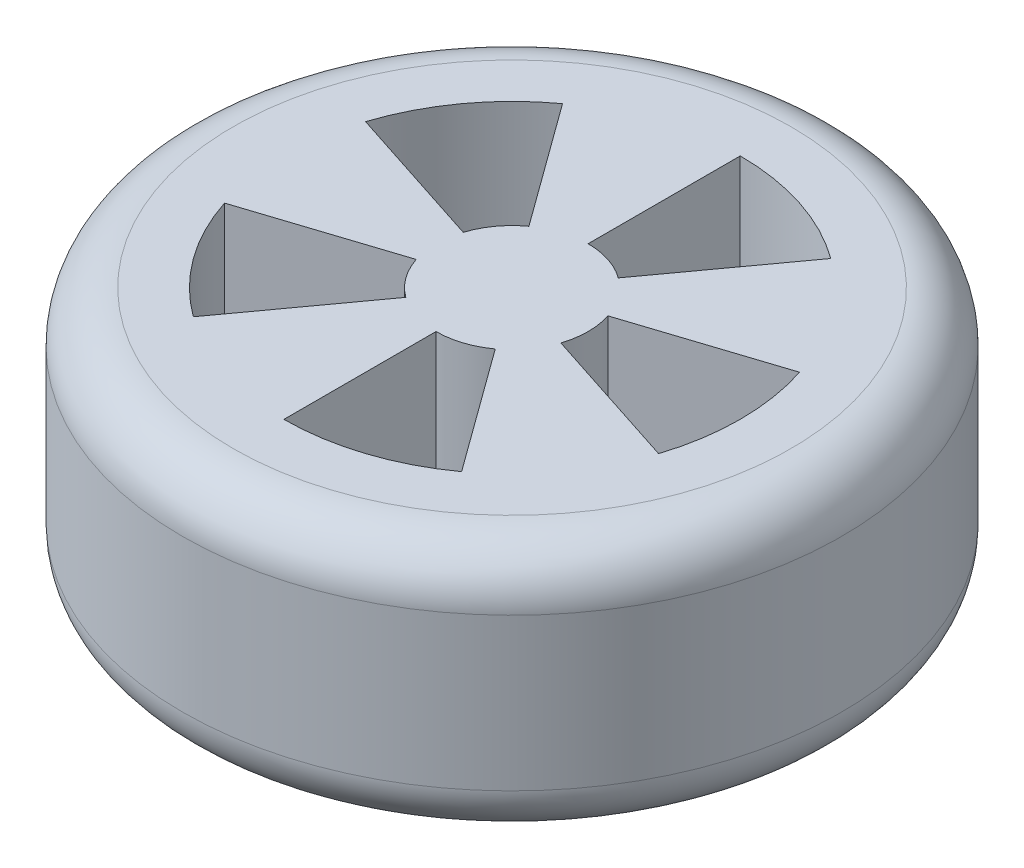
from build123d import *

# Parameters (mm, degrees)
SKETCH_1_R      = 32.5
EXTRUDE_1_DEPTH = 25
FILLET_1_R      = 5
FILLET_2_R      = 5


with BuildPart() as part:
    # 草图1 → 凸台-拉伸1 (new body)
    with BuildSketch(Plane(origin=(0, 0, 0), x_dir=(1, 0, 0), z_dir=(0, 1, 0))):
        with Locations(Location((0, 0, 0), (0, 0, 270))):
            Circle(SKETCH_1_R)
        with BuildLine():
            Line((0, 7.5), (0, 22.5))
            ThreePointArc((0, 22.5), (6.952882373, 21.398771617), (13.225168177, 18.202882373))
            Line((13.225168177, 18.202882373), (4.408389392, 6.067627458))
            ThreePointArc((4.408389392, 6.067627458), (2.317627458, 7.132923872), (0, 7.5))
        make_face(mode=Mode.SUBTRACT)
        with BuildLine():
            Line((7.132923872, 2.317627458), (21.398771617, 6.952882373))
            ThreePointArc((21.398771617, 6.952882373), (22.5, 0), (21.398771617, -6.952882373))
            Line((21.398771617, -6.952882373), (7.132923872, -2.317627458))
            ThreePointArc((7.132923872, -2.317627458), (7.5, 0), (7.132923872, 2.317627458))
        make_face(mode=Mode.SUBTRACT)
        with BuildLine():
            Line((4.408389392, -6.067627458), (13.225168177, -18.202882373))
            ThreePointArc((13.225168177, -18.202882373), (6.952882373, -21.398771617), (0, -22.5))
            Line((0, -22.5), (0, -7.5))
            ThreePointArc((0, -7.5), (2.317627458, -7.132923872), (4.408389392, -6.067627458))
        make_face(mode=Mode.SUBTRACT)
        with BuildLine():
            Line((-4.408389392, -6.067627458), (-13.225168177, -18.202882373))
            ThreePointArc((-13.225168177, -18.202882373), (-18.202882373, -13.225168177), (-21.398771617, -6.952882373))
            Line((-21.398771617, -6.952882373), (-7.132923872, -2.317627458))
            ThreePointArc((-7.132923872, -2.317627458), (-6.067627458, -4.408389392), (-4.408389392, -6.067627458))
        make_face(mode=Mode.SUBTRACT)
        with BuildLine():
            Line((-7.132923872, 2.317627458), (-21.398771617, 6.952882373))
            ThreePointArc((-21.398771617, 6.952882373), (-18.202882373, 13.225168177), (-13.225168177, 18.202882373))
            Line((-13.225168177, 18.202882373), (-4.408389392, 6.067627458))
            ThreePointArc((-4.408389392, 6.067627458), (-6.067627458, 4.408389392), (-7.132923872, 2.317627458))
        make_face(mode=Mode.SUBTRACT)
    extrude(amount=EXTRUDE_1_DEPTH)

    # 圆角1
    fillet_1_edges = [part.edges().sort_by_distance(p)[0] for p in [
        (0, 25, -32.5),
    ]]
    fillet(fillet_1_edges, radius=FILLET_1_R)

    # 圆角2
    fillet_2_edges = [part.edges().sort_by_distance(p)[0] for p in [
        (0, 0, -32.5),
    ]]
    fillet(fillet_2_edges, radius=FILLET_2_R)


solid = part.part
